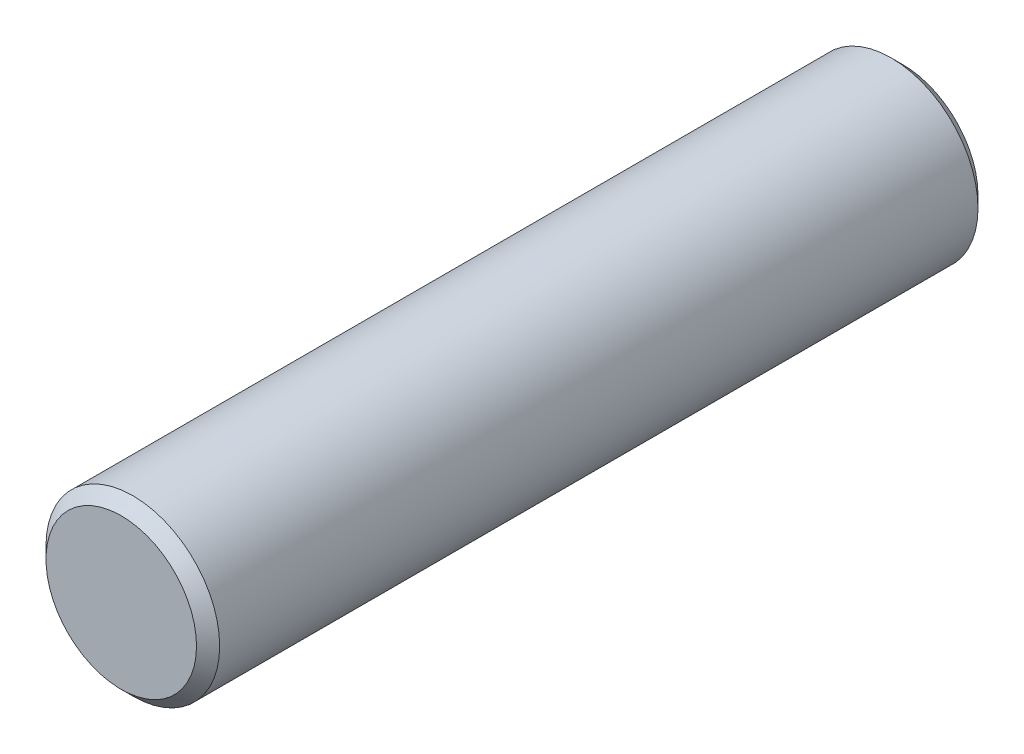
from build123d import *

# Parameters (mm, degrees)
SKETCH1_R           = 1.5
BOSS_EXTRUDE1_DEPTH = 6.75
CHAMFER1_SIZE       = 0.2
CHAMFER2_SIZE       = 0.2


with BuildPart() as part:
    # Sketch1 → Boss-Extrude1 (new, symmetric)
    with BuildSketch(Plane.XY):
        Circle(SKETCH1_R)
    extrude(amount=BOSS_EXTRUDE1_DEPTH, both=True)

    # Chamfer1
    chamfer1_edges = [part.edges().sort_by_distance(p)[0] for p in [
        (-1.5, 0, 6.75),
    ]]
    chamfer(chamfer1_edges, length=CHAMFER1_SIZE)

    # Chamfer2
    chamfer2_edges = [part.edges().sort_by_distance(p)[0] for p in [
        (-1.5, 0, -6.75),
    ]]
    chamfer(chamfer2_edges, length=CHAMFER2_SIZE)


solid = part.part
